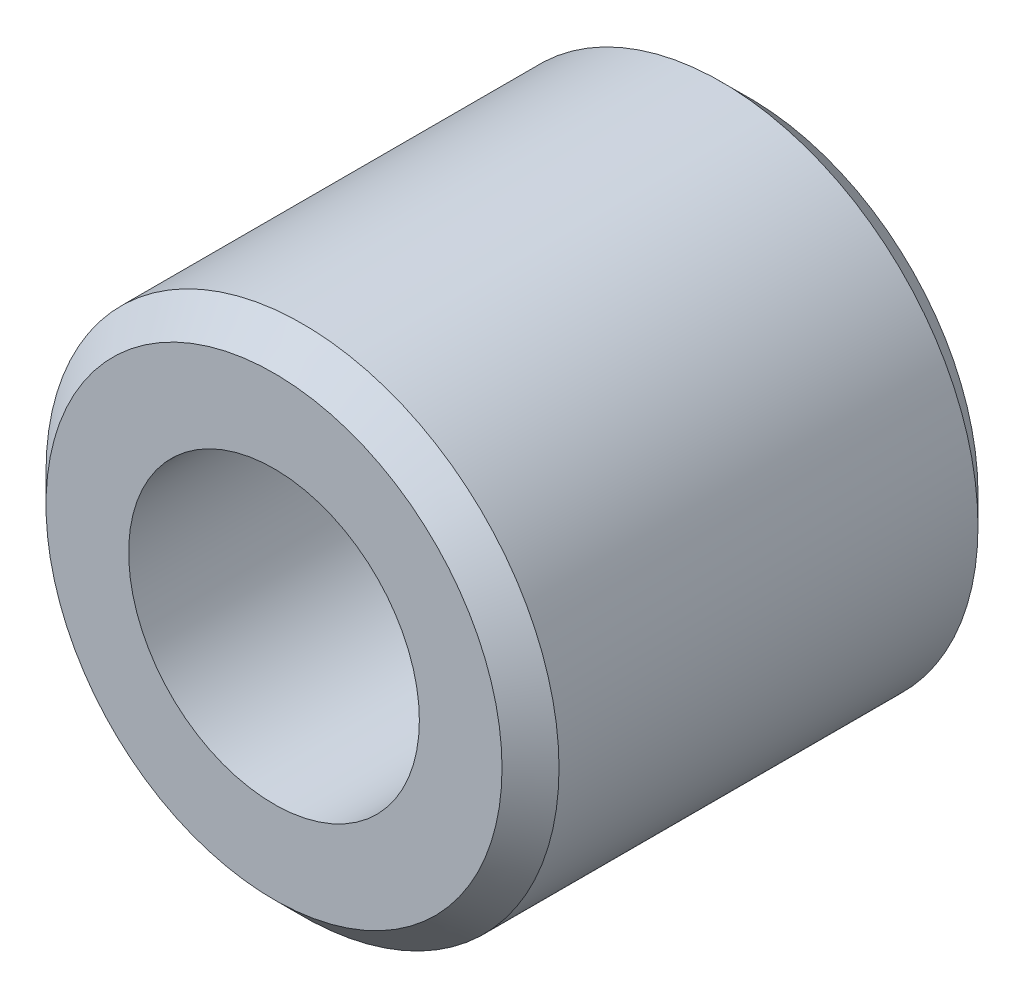
from build123d import *

# Parameters (mm, degrees)
SKETCH1_R           = 4.5
BOSS_EXTRUDE1_DEPTH = 8.35
SKETCH2_R           = 2.55
CUT_EXTRUDE1_DEPTH  = 11.498690395
CHAMFER1_SIZE       = 0.5


with BuildPart() as part:
    # Sketch1 → Boss-Extrude1 (new body)
    with BuildSketch(Plane.XY):
        Circle(SKETCH1_R)
    extrude(amount=BOSS_EXTRUDE1_DEPTH)

    # Sketch2 → Cut-Extrude1 (cut, through all)
    with BuildSketch(Plane.XY):
        Circle(SKETCH2_R)
    extrude(amount=CUT_EXTRUDE1_DEPTH, mode=Mode.SUBTRACT)

    # Chamfer1
    chamfer1_edges = [part.edges().sort_by_distance(p)[0] for p in [
        (-4.5, 0, 0),
        (-4.5, 0, 8.35),
    ]]
    chamfer(chamfer1_edges, length=CHAMFER1_SIZE)


solid = part.part
